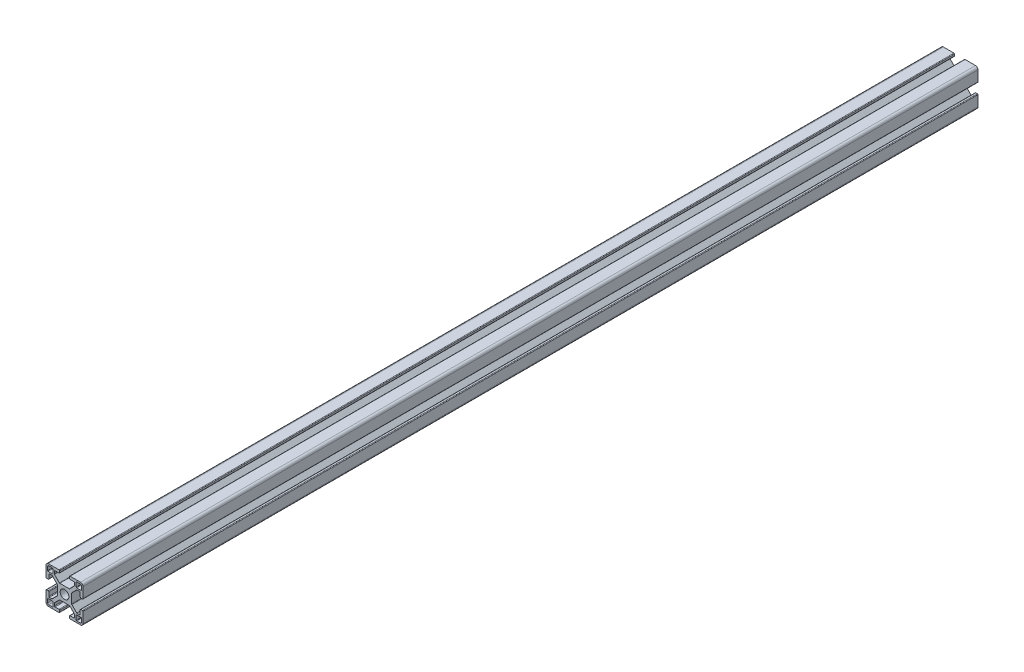
from build123d import *

# Parameters (mm, degrees)
SKETCH1_R           = 3.52998588
BOSS_EXTRUDE1_DEPTH = 362.74375


with BuildPart() as part:
    # Sketch1 → Boss-Extrude1 (new, symmetric)
    with BuildSketch(Plane.XY):
        with BuildLine():
            Line((14.49994, -4), (13.24247465, -4))
            ThreePointArc((13.24247465, -4), (12.88892126, -4.146446609), (12.74247465, -4.5))
            Line((12.74247465, -4.5), (12.74247465, -7.732519321))
            ThreePointArc((12.74247465, -7.732519321), (12.602449697, -8.097296796), (12.242781236, -8.249967))
            Line((12.242781236, -8.249967), (10.260188032, -8.249967))
            ThreePointArc((10.260188032, -8.249967), (10.068847082, -8.211906919), (9.906636056, -8.103520976))
            Line((9.906636056, -8.103520976), (5.981117769, -4.178002689))
            ThreePointArc((5.981117769, -4.178002689), (5.872731827, -4.015791664), (5.834671745, -3.824450713))
            Line((5.834671745, -3.824450713), (5.834671745, -1.01249595))
            Line((5.834671745, -1.01249595), (5.834671745, 0.88749645))
            Line((5.834671745, 0.88749645), (5.834671745, 3.824450713))
            ThreePointArc((5.834671745, 3.824450713), (5.872731827, 4.015791664), (5.981117769, 4.178002689))
            Line((5.981117769, 4.178002689), (9.906636056, 8.103520976))
            ThreePointArc((9.906636056, 8.103520976), (10.068847082, 8.211906919), (10.260188032, 8.249967))
            Line((10.260188032, 8.249967), (12.242781236, 8.249967))
            ThreePointArc((12.242781236, 8.249967), (12.602449697, 8.097296796), (12.74247465, 7.732519321))
            Line((12.74247465, 7.732519321), (12.74247465, 4.5))
            ThreePointArc((12.74247465, 4.5), (12.88892126, 4.146446609), (13.24247465, 4))
            Line((13.24247465, 4), (14.49994, 4))
            ThreePointArc((14.49994, 4), (14.853493391, 4.146446609), (14.99994, 4.5))
            Line((14.99994, 4.5), (14.99994, 12.999948))
            ThreePointArc((14.99994, 12.999948), (14.414155906, 14.414155906), (12.999948, 14.99994))
            Line((12.999948, 14.99994), (4.5, 14.99994))
            ThreePointArc((4.5, 14.99994), (4.146446609, 14.853493391), (4, 14.49994))
            Line((4, 14.49994), (4, 13.24247465))
            ThreePointArc((4, 13.24247465), (4.146446609, 12.88892126), (4.5, 12.74247465))
            Line((4.5, 12.74247465), (7.732519321, 12.74247465))
            ThreePointArc((7.732519321, 12.74247465), (8.097296796, 12.602449697), (8.249967, 12.242781236))
            Line((8.249967, 12.242781236), (8.249967, 10.260188032))
            ThreePointArc((8.249967, 10.260188032), (8.211906919, 10.068847082), (8.103520976, 9.906636056))
            Line((8.103520976, 9.906636056), (4.178002689, 5.981117769))
            ThreePointArc((4.178002689, 5.981117769), (4.015791664, 5.872731827), (3.824450713, 5.834671745))
            Line((3.824450713, 5.834671745), (0.9499962, 5.834671745))
            Line((0.9499962, 5.834671745), (-0.9499962, 5.834671745))
            Line((-0.9499962, 5.834671745), (-3.824450713, 5.834671745))
            ThreePointArc((-3.824450713, 5.834671745), (-4.015791664, 5.872731827), (-4.178002689, 5.981117769))
            Line((-4.178002689, 5.981117769), (-8.103520976, 9.906636056))
            ThreePointArc((-8.103520976, 9.906636056), (-8.211906919, 10.068847082), (-8.249967, 10.260188032))
            Line((-8.249967, 10.260188032), (-8.249967, 12.242781236))
            ThreePointArc((-8.249967, 12.242781236), (-8.097296796, 12.602449697), (-7.732519321, 12.74247465))
            Line((-7.732519321, 12.74247465), (-4.5, 12.74247465))
            ThreePointArc((-4.5, 12.74247465), (-4.146446609, 12.88892126), (-4, 13.24247465))
            Line((-4, 13.24247465), (-4, 14.49994))
            ThreePointArc((-4, 14.49994), (-4.146446609, 14.853493391), (-4.5, 14.99994))
            Line((-4.5, 14.99994), (-12.999948, 14.99994))
            ThreePointArc((-12.999948, 14.99994), (-14.414155906, 14.414155906), (-14.99994, 12.999948))
            Line((-14.99994, 12.999948), (-14.99994, 4.5))
            ThreePointArc((-14.99994, 4.5), (-14.853493391, 4.146446609), (-14.49994, 4))
            Line((-14.49994, 4), (-13.24247465, 4))
            ThreePointArc((-13.24247465, 4), (-12.88892126, 4.146446609), (-12.74247465, 4.5))
            Line((-12.74247465, 4.5), (-12.74247465, 7.732519321))
            ThreePointArc((-12.74247465, 7.732519321), (-12.602449697, 8.097296796), (-12.242781236, 8.249967))
            Line((-12.242781236, 8.249967), (-10.260188032, 8.249967))
            ThreePointArc((-10.260188032, 8.249967), (-10.068847082, 8.211906919), (-9.906636056, 8.103520976))
            Line((-9.906636056, 8.103520976), (-5.981117769, 4.178002689))
            ThreePointArc((-5.981117769, 4.178002689), (-5.872731827, 4.015791664), (-5.834671745, 3.824450713))
            Line((-5.834671745, 3.824450713), (-5.834671745, 0.88749645))
            Line((-5.834671745, 0.88749645), (-5.834671745, -1.01249595))
            Line((-5.834671745, -1.01249595), (-5.834671745, -3.824450713))
            ThreePointArc((-5.834671745, -3.824450713), (-5.872731827, -4.015791664), (-5.981117769, -4.178002689))
            Line((-5.981117769, -4.178002689), (-9.906636056, -8.103520976))
            ThreePointArc((-9.906636056, -8.103520976), (-10.068847082, -8.211906919), (-10.260188032, -8.249967))
            Line((-10.260188032, -8.249967), (-12.242781236, -8.249967))
            ThreePointArc((-12.242781236, -8.249967), (-12.602449697, -8.097296796), (-12.74247465, -7.732519321))
            Line((-12.74247465, -7.732519321), (-12.74247465, -4.5))
            ThreePointArc((-12.74247465, -4.5), (-12.88892126, -4.146446609), (-13.24247465, -4))
            Line((-13.24247465, -4), (-14.49994, -4))
            ThreePointArc((-14.49994, -4), (-14.853493391, -4.146446609), (-14.99994, -4.5))
            Line((-14.99994, -4.5), (-14.99994, -12.999948))
            ThreePointArc((-14.99994, -12.999948), (-14.414155906, -14.414155906), (-12.999948, -14.99994))
            Line((-12.999948, -14.99994), (-4.5, -14.99994))
            ThreePointArc((-4.5, -14.99994), (-4.146446609, -14.853493391), (-4, -14.49994))
            Line((-4, -14.49994), (-4, -13.24247465))
            ThreePointArc((-4, -13.24247465), (-4.146446609, -12.88892126), (-4.5, -12.74247465))
            Line((-4.5, -12.74247465), (-7.732519321, -12.74247465))
            ThreePointArc((-7.732519321, -12.74247465), (-8.097296796, -12.602449697), (-8.249967, -12.242781236))
            Line((-8.249967, -12.242781236), (-8.249967, -10.260188032))
            ThreePointArc((-8.249967, -10.260188032), (-8.211906919, -10.068847082), (-8.103520976, -9.906636056))
            Line((-8.103520976, -9.906636056), (-4.178002689, -5.981117769))
            ThreePointArc((-4.178002689, -5.981117769), (-4.015791664, -5.872731827), (-3.824450713, -5.834671745))
            Line((-3.824450713, -5.834671745), (-0.9499962, -5.834671745))
            Line((-0.9499962, -5.834671745), (0.9499962, -5.834671745))
            Line((0.9499962, -5.834671745), (3.824450713, -5.834671745))
            ThreePointArc((3.824450713, -5.834671745), (4.015791664, -5.872731827), (4.178002689, -5.981117769))
            Line((4.178002689, -5.981117769), (8.103520976, -9.906636056))
            ThreePointArc((8.103520976, -9.906636056), (8.211906919, -10.068847082), (8.249967, -10.260188032))
            Line((8.249967, -10.260188032), (8.249967, -12.242781236))
            ThreePointArc((8.249967, -12.242781236), (8.097296796, -12.602449697), (7.732519321, -12.74247465))
            Line((7.732519321, -12.74247465), (4.5, -12.74247465))
            ThreePointArc((4.5, -12.74247465), (4.146446609, -12.88892126), (4, -13.24247465))
            Line((4, -13.24247465), (4, -14.49994))
            ThreePointArc((4, -14.49994), (4.146446609, -14.853493391), (4.5, -14.99994))
            Line((4.5, -14.99994), (12.999948, -14.99994))
            ThreePointArc((12.999948, -14.99994), (14.414155906, -14.414155906), (14.99994, -12.999948))
            Line((14.99994, -12.999948), (14.99994, -4.5))
            ThreePointArc((14.99994, -4.5), (14.853493391, -4.146446609), (14.49994, -4))
        make_face()
        Circle(SKETCH1_R, mode=Mode.SUBTRACT)
        with BuildLine():
            Line((-12.6999492, -13.6999452), (-9.880960476, -13.6999452))
            ThreePointArc((-9.880960476, -13.6999452), (-9.61155387, -13.58835333), (-9.499962, -13.318946724))
            Line((-9.499962, -13.318946724), (-9.499962, -9.87996048))
            ThreePointArc((-9.499962, -9.87996048), (-9.611260978, -9.611260978), (-9.87996048, -9.499962))
            Line((-9.87996048, -9.499962), (-13.318946724, -9.499962))
            ThreePointArc((-13.318946724, -9.499962), (-13.58835333, -9.61155387), (-13.6999452, -9.880960476))
            Line((-13.6999452, -9.880960476), (-13.6999452, -12.6999492))
            ThreePointArc((-13.6999452, -12.6999492), (-13.407053153, -13.407053153), (-12.6999492, -13.6999452))
        make_face(mode=Mode.SUBTRACT)
        with BuildLine():
            Line((13.6999452, -12.6999492), (13.6999452, -9.880960476))
            ThreePointArc((13.6999452, -9.880960476), (13.58835333, -9.61155387), (13.318946724, -9.499962))
            Line((13.318946724, -9.499962), (9.87996048, -9.499962))
            ThreePointArc((9.87996048, -9.499962), (9.611260978, -9.611260978), (9.499962, -9.87996048))
            Line((9.499962, -9.87996048), (9.499962, -13.318946724))
            ThreePointArc((9.499962, -13.318946724), (9.61155387, -13.58835333), (9.880960476, -13.6999452))
            Line((9.880960476, -13.6999452), (12.6999492, -13.6999452))
            ThreePointArc((12.6999492, -13.6999452), (13.407053153, -13.407053153), (13.6999452, -12.6999492))
        make_face(mode=Mode.SUBTRACT)
        with BuildLine():
            Line((9.87996048, 9.499962), (13.318946724, 9.499962))
            ThreePointArc((13.318946724, 9.499962), (13.58835333, 9.61155387), (13.6999452, 9.880960476))
            Line((13.6999452, 9.880960476), (13.6999452, 12.6999492))
            ThreePointArc((13.6999452, 12.6999492), (13.407053153, 13.407053153), (12.6999492, 13.6999452))
            Line((12.6999492, 13.6999452), (9.880960476, 13.6999452))
            ThreePointArc((9.880960476, 13.6999452), (9.61155387, 13.58835333), (9.499962, 13.318946724))
            Line((9.499962, 13.318946724), (9.499962, 9.87996048))
            ThreePointArc((9.499962, 9.87996048), (9.611260978, 9.611260978), (9.87996048, 9.499962))
        make_face(mode=Mode.SUBTRACT)
        with BuildLine():
            Line((-13.6999452, 12.6999492), (-13.6999452, 9.880960476))
            ThreePointArc((-13.6999452, 9.880960476), (-13.58835333, 9.61155387), (-13.318946724, 9.499962))
            Line((-13.318946724, 9.499962), (-9.87996048, 9.499962))
            ThreePointArc((-9.87996048, 9.499962), (-9.611260978, 9.611260978), (-9.499962, 9.87996048))
            Line((-9.499962, 9.87996048), (-9.499962, 13.318946724))
            ThreePointArc((-9.499962, 13.318946724), (-9.61155387, 13.58835333), (-9.880960476, 13.6999452))
            Line((-9.880960476, 13.6999452), (-12.6999492, 13.6999452))
            ThreePointArc((-12.6999492, 13.6999452), (-13.407053153, 13.407053153), (-13.6999452, 12.6999492))
        make_face(mode=Mode.SUBTRACT)
    extrude(amount=BOSS_EXTRUDE1_DEPTH, both=True)


solid = part.part
